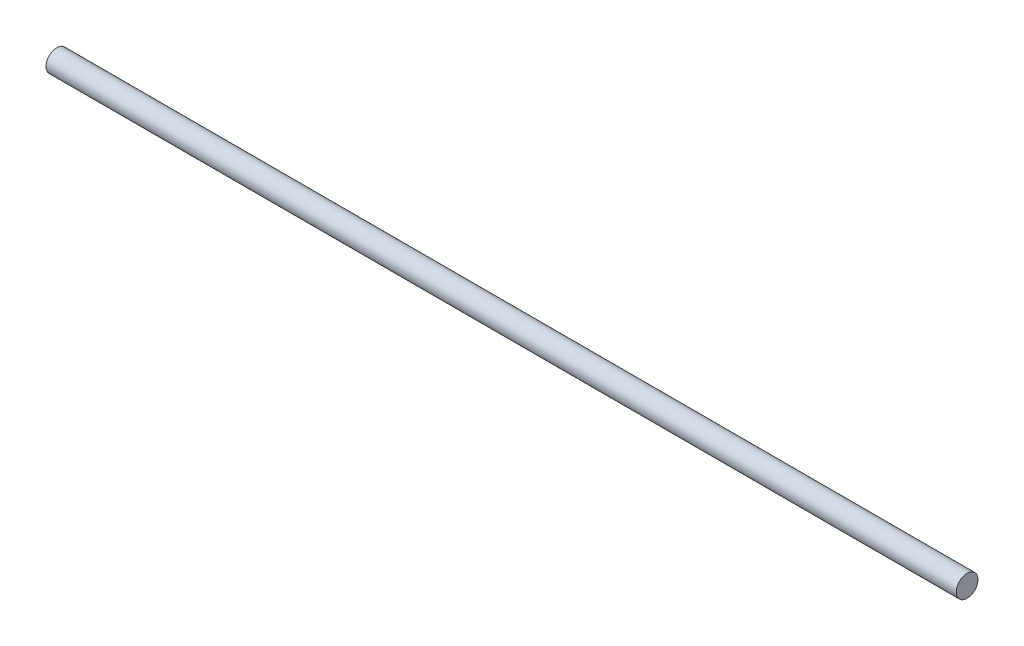
from build123d import *

# Parameters (mm, degrees)
ESBO_O1_R                = 4
RESSALTO_EXTRUS_O1_DEPTH = 167.5


with BuildPart() as part:
    # Esboço1 → Ressalto-extrusão1 (new, symmetric)
    with BuildSketch(Plane(origin=(0, 0, 0), x_dir=(0, 0, -1), z_dir=(1, 0, 0))):
        Circle(ESBO_O1_R)
    extrude(amount=RESSALTO_EXTRUS_O1_DEPTH, both=True)


solid = part.part
